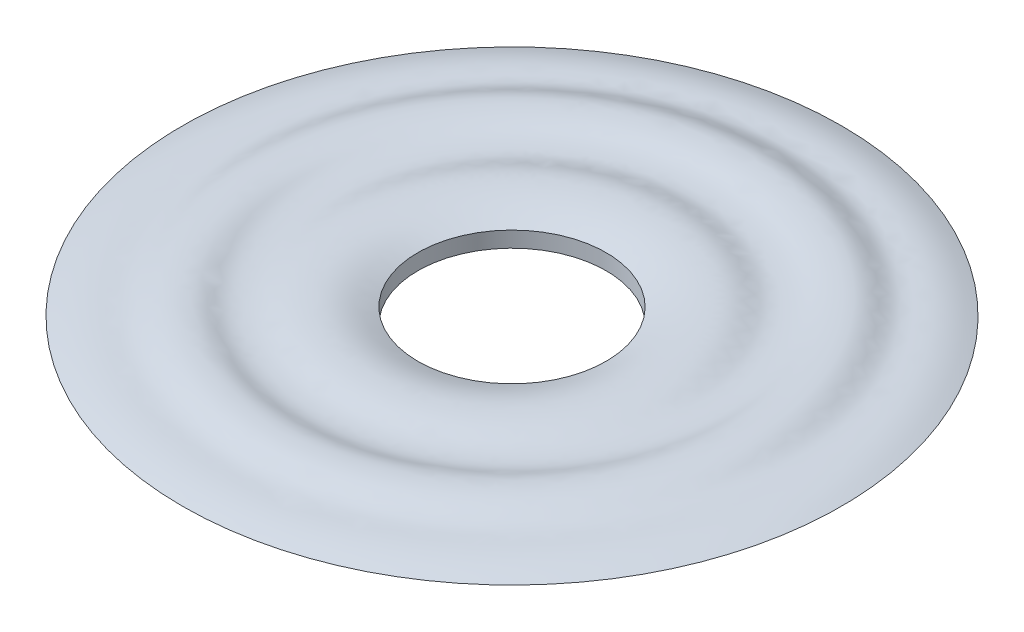
from build123d import *


with BuildPart() as part:
    # Sketch1 → Revolve1 (revolve)
    with BuildSketch(Plane.XY, mode=Mode.PRIVATE) as revolve1_sk:
        with BuildLine():
            Line((36, 3), (36, -3))
            add(Edge.make_bspline(
                [(36, -3), (40.585230131, -4.807661018), (46.281620785, -7.053381088), (62.504231047, -6.988046791), (65.815384329, -3.844157204), (80.639817917, -4.142677913), (81.410062476, -6.906615676), (97.650123006, -7.144420917), (100.759507117, -2.724428729), (116.689065098, -3.298106994), (121.796433134, -1.488981872), (126, 0)],
                knots=[0, 0, 0, 0, 0.134921489, 0.167617652, 0.309256744, 0.350321337, 0.537198992, 0.581793546, 0.751672323, 0.795616453, 1, 1, 1, 1], degree=3))
            add(Edge.make_bspline(
                [(36, 3), (40.585230131, 4.807661018), (46.281620785, 7.053381088), (62.504231047, 6.988046791), (65.815384329, 3.844157204), (80.639817917, 4.142677913), (81.410062476, 6.906615676), (97.650123006, 7.144420917), (100.759507117, 2.724428729), (116.689065098, 3.298106994), (121.796433134, 1.488981872), (126, 0)],
                knots=[0, 0, 0, 0, 0.134921489, 0.167617652, 0.309256744, 0.350321337, 0.537198992, 0.581793546, 0.751672323, 0.795616453, 1, 1, 1, 1], degree=3))
        make_face()
    revolve(revolve1_sk.sketch.rotate(Axis((0, 2.615880625, 0), (0, -1, 0)), 90), axis=Axis((0, 2.615880625, 0), (0, -1, 0)))


solid = part.part
